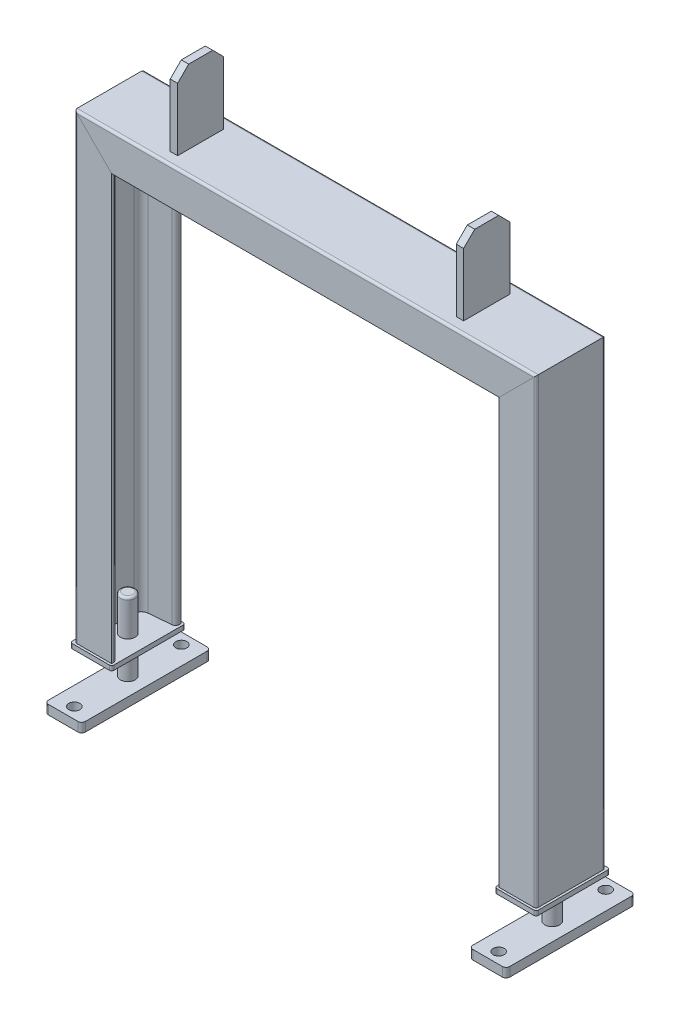
from build123d import *

# Parameters (mm, degrees)
CHANNEL_C_75_X_40_X_5_0_1_DEPTH        = 623.5
CHANNEL_C_75_X_40_X_5_0_1_2_DEPTH      = 747
CHANNEL_C_75_X_40_X_5_0_1_3_DEPTH      = 500
CHANNEL_C_75_X_40_X_5_0_1_3_DEPTH_BACK = 123.5
SKETCH15_R                             = 8
BOSS_EXTRUDE1_DEPTH                    = 5
BOSS_EXTRUDE1_2_DEPTH                  = 5
FILLET1_R                              = 2.5
FILLET2_R                              = 2.5
FILLET3_R                              = 2.5
SKETCH16_W                             = 8
SKETCH16_H                             = 50
BOSS_EXTRUDE2_DEPTH                    = 80
BOSS_EXTRUDE2_2_DEPTH                  = 80
CHAMFER1_SIZE                          = 12
CHAMFER2_SIZE                          = 12
BOSS_EXTRUDE3_DEPTH                    = 35
BOSS_EXTRUDE3_DEPTH_BACK               = 44
SKETCH17_R                             = 8
BOSS_EXTRUDE3_2_DEPTH                  = 35
BOSS_EXTRUDE3_2_DEPTH_BACK             = 44
FILLET6_R                              = 2.5
FILLET7_R                              = 2.5
SKETCH18_R                             = 6
BOSS_EXTRUDE4_DEPTH                    = 10
BOSS_EXTRUDE4_2_DEPTH                  = 10


with BuildPart() as part:
    # Sketch14 on segment 1 (carried to segment 1) → Channel C 75 X 40 X 5.0(1) (new body)
    with BuildSketch(Plane(origin=(250, -500, -37.5), x_dir=(-1, 0, 0), z_dir=(0, 1, 0))):
        with BuildLine():
            Line((40, 75), (0, 75))
            Line((0, 75), (0, 0))
            Line((0, 0), (40, 0))
            Line((40, 0), (40, 1.803623692))
            ThreePointArc((40, 1.803623692), (38.949109347, 4.505984523), (36.348622971, 5.788402485))
            Line((36.348622971, 5.788402485), (12.302754058, 7.892143419))
            ThreePointArc((12.302754058, 7.892143419), (7.101781306, 10.456979343), (5, 15.861701004))
            Line((5, 15.861701004), (5, 59.138298996))
            ThreePointArc((5, 59.138298996), (7.101781306, 64.543020657), (12.302754058, 67.107856581))
            Line((12.302754058, 67.107856581), (36.348622971, 69.211597515))
            ThreePointArc((36.348622971, 69.211597515), (38.949109347, 70.494015477), (40, 73.196376308))
            Line((40, 73.196376308), (40, 75))
        make_face()
    extrude(amount=CHANNEL_C_75_X_40_X_5_0_1_DEPTH)

    # Channel C 75 X 40 X 5.0(1) mitre 1
    split(bisect_by=Plane(origin=(250, 0, 0), x_dir=(0.707106781, 0.707106781, 0), z_dir=(0.707106781, -0.707106781, 0)), keep=Keep.TOP)

    # Fillet3
    fillet3_edges = [part.edges().sort_by_distance(p)[0] for p in [
        (250, -250, 37.5),
        (250, -250, -37.5),
    ]]
    fillet(fillet3_edges, radius=FILLET3_R)


with BuildPart() as body_2:
    # Sketch14 on segment 2 (carried to segment 2) → Channel C 75 X 40 X 5.0_1 2 (new body)
    with BuildSketch(Plane(origin=(373.5, 0, -37.5), x_dir=(0, -1, 0), z_dir=(-1, 0, 0))):
        with BuildLine():
            Line((40, 75), (0, 75))
            Line((0, 75), (0, 0))
            Line((0, 0), (40, 0))
            Line((40, 0), (40, 1.803623692))
            ThreePointArc((40, 1.803623692), (38.949109347, 4.505984523), (36.348622971, 5.788402485))
            Line((36.348622971, 5.788402485), (12.302754058, 7.892143419))
            ThreePointArc((12.302754058, 7.892143419), (7.101781306, 10.456979343), (5, 15.861701004))
            Line((5, 15.861701004), (5, 59.138298996))
            ThreePointArc((5, 59.138298996), (7.101781306, 64.543020657), (12.302754058, 67.107856581))
            Line((12.302754058, 67.107856581), (36.348622971, 69.211597515))
            ThreePointArc((36.348622971, 69.211597515), (38.949109347, 70.494015477), (40, 73.196376308))
            Line((40, 73.196376308), (40, 75))
        make_face()
    extrude(amount=CHANNEL_C_75_X_40_X_5_0_1_2_DEPTH)

    # Channel C 75 X 40 X 5.0_1 2 mitre 1
    split(bisect_by=Plane(origin=(250, 0, 0), x_dir=(-0.707106781, -0.707106781, 0), z_dir=(-0.707106781, 0.707106781, 0)), keep=Keep.TOP)

    # Channel C 75 X 40 X 5.0_1 2 mitre 2
    split(bisect_by=Plane(origin=(-250, 0, 0), x_dir=(-0.707106781, 0.707106781, 0), z_dir=(0.707106781, 0.707106781, 0)), keep=Keep.TOP)

    # Fillet2
    fillet2_edges = [body_2.edges().sort_by_distance(p)[0] for p in [
        (0, 0, 37.5),
        (0, 0, -37.5),
    ]]
    fillet(fillet2_edges, radius=FILLET2_R)


with BuildPart() as body_3:
    # Sketch14 → Channel C 75 X 40 X 5.0_1 3 (new, two sides: drawn at the far end of the back side and taken through both)
    with BuildSketch(Plane(origin=(-250, 0, -37.5), x_dir=(1, 0, 0), z_dir=(0, -1, 0)).offset(-CHANNEL_C_75_X_40_X_5_0_1_3_DEPTH_BACK)):
        with BuildLine():
            Line((40, 75), (0, 75))
            Line((0, 75), (0, 0))
            Line((0, 0), (40, 0))
            Line((40, 0), (40, 1.803623692))
            ThreePointArc((40, 1.803623692), (38.949109347, 4.505984523), (36.348622971, 5.788402485))
            Line((36.348622971, 5.788402485), (12.302754058, 7.892143419))
            ThreePointArc((12.302754058, 7.892143419), (7.101781306, 10.456979343), (5, 15.861701004))
            Line((5, 15.861701004), (5, 59.138298996))
            ThreePointArc((5, 59.138298996), (7.101781306, 64.543020657), (12.302754058, 67.107856581))
            Line((12.302754058, 67.107856581), (36.348622971, 69.211597515))
            ThreePointArc((36.348622971, 69.211597515), (38.949109347, 70.494015477), (40, 73.196376308))
            Line((40, 73.196376308), (40, 75))
        make_face()
    extrude(amount=CHANNEL_C_75_X_40_X_5_0_1_3_DEPTH + CHANNEL_C_75_X_40_X_5_0_1_3_DEPTH_BACK)

    # Channel C 75 X 40 X 5.0_1 3 mitre 1
    split(bisect_by=Plane(origin=(-250, 0, 0), x_dir=(0.707106781, -0.707106781, 0), z_dir=(-0.707106781, -0.707106781, 0)), keep=Keep.TOP)

    # Fillet1
    fillet1_edges = [body_3.edges().sort_by_distance(p)[0] for p in [
        (-250, -250, 37.5),
        (-250, -250, -37.5),
    ]]
    fillet(fillet1_edges, radius=FILLET1_R)


with BuildPart() as body_4:
    # Sketch15 → Boss-Extrude1 (new body)
    with BuildSketch(Plane.XZ.offset(500)):
        with BuildLine():
            Line((-252.5, 37.5), (-252.5, -37.5))
            ThreePointArc((-252.5, -37.5), (-251.767766953, -39.267766953), (-250, -40))
            Line((-250, -40), (-210, -40))
            ThreePointArc((-210, -40), (-208.232233047, -39.267766953), (-207.5, -37.5))
            Line((-207.5, -37.5), (-207.5, 37.5))
            ThreePointArc((-207.5, 37.5), (-208.232233047, 39.267766953), (-210, 40))
            Line((-210, 40), (-250, 40))
            ThreePointArc((-250, 40), (-251.767766953, 39.267766953), (-252.5, 37.5))
        make_face()
        with Locations((-230, 0)):
            Circle(SKETCH15_R, mode=Mode.SUBTRACT)
    extrude(amount=BOSS_EXTRUDE1_DEPTH)


with BuildPart() as body_5:
    # Sketch15 → Boss-Extrude1 2 (new body)
    with BuildSketch(Plane.XZ.offset(500)):
        with BuildLine():
            Line((252.5, -37.5), (252.5, 37.5))
            ThreePointArc((252.5, 37.5), (251.767766953, 39.267766953), (250, 40))
            Line((250, 40), (210, 40))
            ThreePointArc((210, 40), (208.232233047, 39.267766953), (207.5, 37.5))
            Line((207.5, 37.5), (207.5, -37.5))
            ThreePointArc((207.5, -37.5), (208.232233047, -39.267766953), (210, -40))
            Line((210, -40), (250, -40))
            ThreePointArc((250, -40), (251.767766953, -39.267766953), (252.5, -37.5))
        make_face()
        with Locations(Location((230, 0, 0), (0, 0, 180))):
            Circle(SKETCH15_R, mode=Mode.SUBTRACT)
    extrude(amount=BOSS_EXTRUDE1_2_DEPTH)


with BuildPart() as body_6:
    # Sketch16 → Boss-Extrude2 (new body)
    with BuildSketch(Plane(origin=(0, 0, 0), x_dir=(1, 0, 0), z_dir=(0, 1, 0))):
        with Locations((-155, 0)):
            Rectangle(SKETCH16_W, SKETCH16_H)
    extrude(amount=BOSS_EXTRUDE2_DEPTH)

    # Chamfer1
    chamfer1_edges = [body_6.edges().sort_by_distance(p)[0] for p in [
        (-155, 80, -25),
        (-155, 80, 25),
    ]]
    chamfer(chamfer1_edges, length=CHAMFER1_SIZE)


with BuildPart() as body_7:
    # Sketch16 → Boss-Extrude2 2 (new body)
    with BuildSketch(Plane(origin=(0, 0, 0), x_dir=(1, 0, 0), z_dir=(0, 1, 0))):
        with Locations((155, 0)):
            Rectangle(SKETCH16_W, SKETCH16_H)
    extrude(amount=BOSS_EXTRUDE2_2_DEPTH)

    # Chamfer2
    chamfer2_edges = [body_7.edges().sort_by_distance(p)[0] for p in [
        (155, 80, 25),
        (155, 80, -25),
    ]]
    chamfer(chamfer2_edges, length=CHAMFER2_SIZE)


with BuildPart() as body_8:
    # Sketch17 → Boss-Extrude3 (new, two sides: drawn at the far end of the back side and taken through both)
    with BuildSketch(Plane.XZ.offset(505).offset(-BOSS_EXTRUDE3_DEPTH_BACK)):
        with Locations((-230, 0)):
            Circle(SKETCH17_R)
    extrude(amount=BOSS_EXTRUDE3_DEPTH + BOSS_EXTRUDE3_DEPTH_BACK)

    # Fillet6
    fillet6_edges = [body_8.edges().sort_by_distance(p)[0] for p in [
        (-238, -461, 0),
    ]]
    fillet(fillet6_edges, radius=FILLET6_R)


with BuildPart() as body_9:
    # Sketch17 → Boss-Extrude3 2 (new, two sides: drawn at the far end of the back side and taken through both)
    with BuildSketch(Plane.XZ.offset(505).offset(-BOSS_EXTRUDE3_2_DEPTH_BACK)):
        with Locations(Location((230, 0, 0), (0, 0, 180))):
            Circle(SKETCH17_R)
    extrude(amount=BOSS_EXTRUDE3_2_DEPTH + BOSS_EXTRUDE3_2_DEPTH_BACK)

    # Fillet7
    fillet7_edges = [body_9.edges().sort_by_distance(p)[0] for p in [
        (238, -461, 0),
    ]]
    fillet(fillet7_edges, radius=FILLET7_R)


with BuildPart() as body_10:
    # Sketch18 → Boss-Extrude4 (new body)
    with BuildSketch(Plane.XZ.offset(540)):
        with BuildLine():
            Line((-246, -70), (-214, -70))
            ThreePointArc((-214, -70), (-211.171572875, -68.828427125), (-210, -66))
            Line((-210, -66), (-210, 66))
            ThreePointArc((-210, 66), (-211.171572875, 68.828427125), (-214, 70))
            Line((-214, 70), (-246, 70))
            ThreePointArc((-246, 70), (-248.828427125, 68.828427125), (-250, 66))
            Line((-250, 66), (-250, -66))
            ThreePointArc((-250, -66), (-248.828427125, -68.828427125), (-246, -70))
        make_face()
        with Locations((-230, 58)):
            Circle(SKETCH18_R, mode=Mode.SUBTRACT)
        with Locations((-230, -58)):
            Circle(SKETCH18_R, mode=Mode.SUBTRACT)
    extrude(amount=BOSS_EXTRUDE4_DEPTH)


with BuildPart() as body_11:
    # Sketch18 → Boss-Extrude4 2 (new body)
    with BuildSketch(Plane.XZ.offset(540)):
        with BuildLine():
            Line((210, -66), (210, 66))
            ThreePointArc((210, 66), (211.171572875, 68.828427125), (214, 70))
            Line((214, 70), (246, 70))
            ThreePointArc((246, 70), (248.828427125, 68.828427125), (250, 66))
            Line((250, 66), (250, -66))
            ThreePointArc((250, -66), (248.828427125, -68.828427125), (246, -70))
            Line((246, -70), (214, -70))
            ThreePointArc((214, -70), (211.171572875, -68.828427125), (210, -66))
        make_face()
        with Locations(Location((230, -58, 0), (0, 0, 180))):
            Circle(SKETCH18_R, mode=Mode.SUBTRACT)
        with Locations(Location((230, 58, 0), (0, 0, 180))):
            Circle(SKETCH18_R, mode=Mode.SUBTRACT)
    extrude(amount=BOSS_EXTRUDE4_2_DEPTH)


solid = Compound([part.part, body_2.part, body_3.part, body_4.part, body_5.part, body_6.part, body_7.part, body_8.part, body_9.part, body_10.part, body_11.part])
